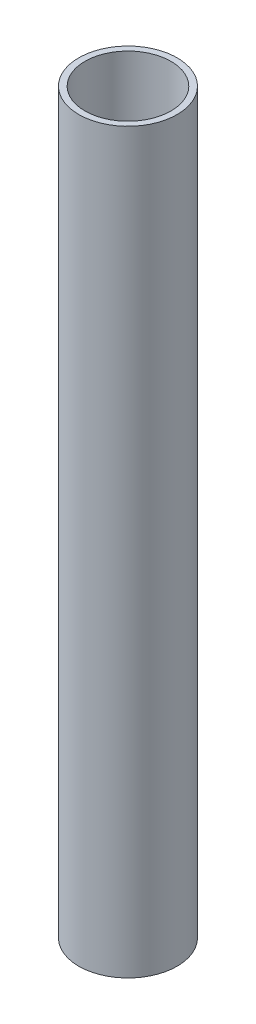
from build123d import *

# Parameters (mm, degrees)
SKETCH1_R           = 4
SKETCH1_R_2         = 3.5
BOSS_EXTRUDE1_DEPTH = 60


with BuildPart() as part:
    # Sketch1 → Boss-Extrude1 (new body)
    with BuildSketch(Plane(origin=(0, 0, 0), x_dir=(1, 0, 0), z_dir=(0, 1, 0))):
        with Locations(Location((0, 0, 0), (0, 0, 270))):
            Circle(SKETCH1_R)
        with Locations(Location((0, 0, 0), (0, 0, 270))):
            Circle(SKETCH1_R_2, mode=Mode.SUBTRACT)
    extrude(amount=BOSS_EXTRUDE1_DEPTH)


solid = part.part
